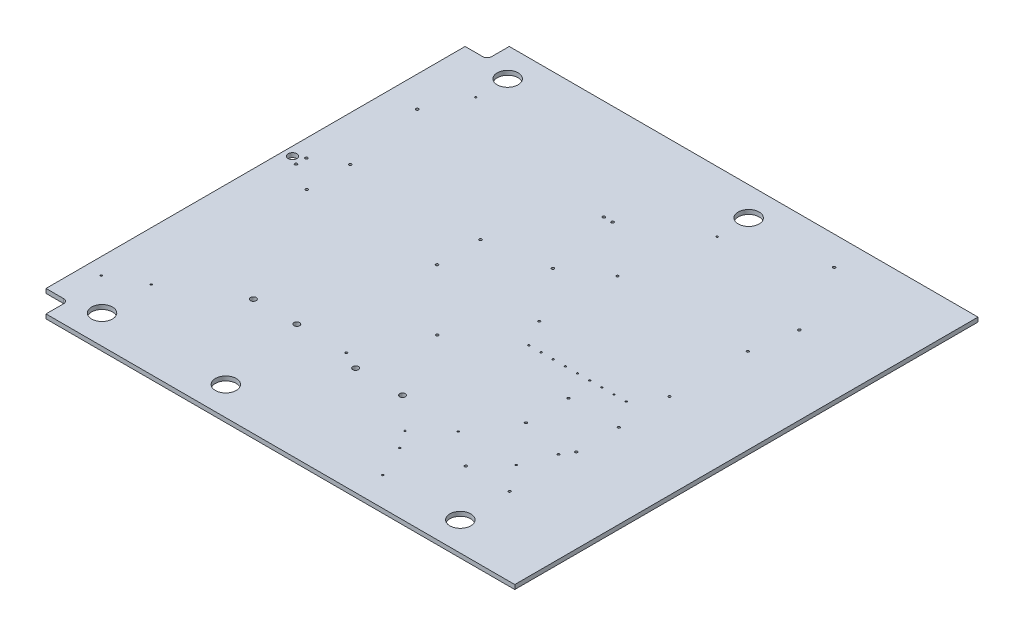
from build123d import *

# Parameters (mm, degrees)
SKETCH1_W                                     = 533.4
SKETCH1_H                                     = 5
BOSS_EXTRUDE1_DEPTH                           = 565.15
BOTTHOMHOLES_SKETCH2_R                        = 12
BOTTOMSTEPPERHOLES_CUT_EXTRUDE1_DEPTH         = 778.132602906
BOTTOMPSUHOLESSKETCH2_R                       = 1.5
BOTTOMPSUHOLESSKETCH2_R_2                     = 3.25
BOTTOMPSUHOLESCUT_EXTRUDE1_DEPTH              = 778.132602906
OCTOPUSHOLESSKETCH2_R                         = 1.35
OCTOPUSMOUNTHOLESCUT_EXTRUDE1_DEPTH           = 778.132602906
POWRCABLEGUIDEMOUNTHOLESSKETCH2_R             = 1.5
POWERCABLEGUIDEMOUNTHOLESCUT_EXTRUDE1_DEPTH   = 778.132602906
RPIHOLESSKETCH2_R                             = 1.35
RPIMOUNTHOLESCUT_EXTRUDE1_DEPTH               = 778.132602906
DRAGCHAINANDCABLEGUIDEHOLESSKETCH2_R          = 1.5
DRAGCHAINANDCABLEGUIDEHOLESSKETCH2_R_2        = 5
CRAGCHAINANDCABLEGUIDEHOLESCUT_EXTRUDE1_DEPTH = 778.132602906
SKETCH2_R                                     = 1
OCTOPUSROUTING_HOLESCUT_EXTRUDE1_DEPTH        = 778.132602906
PIPOWERANDSSRCONTROLSKETCH3_R                 = 1.25
PIPOWERANDSSRCONTROLCUTS_EXTRUDE1_DEPTH       = 778.132602906
CORNERCABLEKNOTCHCUT_EXTRUDE1_DEPTH           = 778.132602906
Z1_PATHSSKETCH4_R                             = 1.5
Z1_PATGSCUT_EXTRUDE1_DEPTH                    = 778.132602906
Z2PATHSSKETCH5_R                              = 1
Z2PATHSCUT_EXTRUDE2_DEPTH                     = 778.132602906
ZPATHSSKETCH4_R                               = 1.35
ZPATHSCUT_EXTRUDE1_DEPTH                      = 778.132602906
LEFTGANTRYANDEXTRUDERPATHSSKETCH4_R           = 1
LEFTGANTRYANDEXTRUDERPATHSCUT_EXTRUDE1_DEPTH  = 778.132602906
RIGHTGANTRYPATHSSKETCH5_R                     = 1
RIGHTGANTRYPATHSCUT_EXTRUDE2_DEPTH            = 778.132602906


with BuildPart() as part:
    # Sketch1 → Boss-Extrude1 (new body)
    with BuildSketch(Plane(origin=(0, 0, 0), x_dir=(0, 0, -1), z_dir=(1, 0, 0))):
        with Locations((-266.7, 2.5)):
            Rectangle(SKETCH1_W, SKETCH1_H)
    extrude(amount=BOSS_EXTRUDE1_DEPTH)

    # BotthomHoles-Sketch2 → BottomStepperHoles-Cut-Extrude1 (cut, through all)
    with BuildSketch(Plane(origin=(0, 5, 0), x_dir=(1, 0, 0), z_dir=(0, 1, 0))):
        with Locations(Location((334.275, -33.175, 0), (0, 0, 270))):
            Circle(BOTTHOMHOLES_SKETCH2_R)
        with Locations(Location((199.275, -500.225, 0), (0, 0, 270))):
            Circle(BOTTHOMHOLES_SKETCH2_R)
        with Locations(Location((469.275, -500.225, 0), (0, 0, 270))):
            Circle(BOTTHOMHOLES_SKETCH2_R)
        with Locations(Location((56.75, -500.225, 0), (0, 0, 270))):
            Circle(BOTTHOMHOLES_SKETCH2_R)
        with Locations(Location((56.75, -33.175, 0), (0, 0, 270))):
            Circle(BOTTHOMHOLES_SKETCH2_R)
    extrude(amount=-BOTTOMSTEPPERHOLES_CUT_EXTRUDE1_DEPTH, mode=Mode.SUBTRACT)

    # BottomPSUHolesSketch2 → BottomPSUHolesCut-Extrude1 (cut, through all)
    with BuildSketch(Plane(origin=(0, 5, 0), x_dir=(1, 0, 0), z_dir=(0, 1, 0))):
        with Locations(Location((201.5, -209.2, 0), (0, 0, 270))):
            Circle(BOTTOMPSUHOLESSKETCH2_R)
        with Locations(Location((201.5, -259.2, 0), (0, 0, 270))):
            Circle(BOTTOMPSUHOLESSKETCH2_R)
        with Locations(Location((51.5, -209.2, 0), (0, 0, 270))):
            Circle(BOTTOMPSUHOLESSKETCH2_R)
        with Locations(Location((51.5, -259.2, 0), (0, 0, 270))):
            Circle(BOTTOMPSUHOLESSKETCH2_R)
        with Locations(Location((180, -399.2, 0), (0, 0, 270))):
            Circle(BOTTOMPSUHOLESSKETCH2_R_2)
        with Locations(Location((130, -399.2, 0), (0, 0, 270))):
            Circle(BOTTOMPSUHOLESSKETCH2_R_2)
        with Locations(Location((257.75, -409.2, 0), (0, 0, 270))):
            Circle(BOTTOMPSUHOLESSKETCH2_R_2)
        with Locations(Location((311.75, -409.2, 0), (0, 0, 270))):
            Circle(BOTTOMPSUHOLESSKETCH2_R_2)
    extrude(amount=-BOTTOMPSUHOLESCUT_EXTRUDE1_DEPTH, mode=Mode.SUBTRACT)

    # OctopusHolesSketch2 → OctopusMountHolesCut-Extrude1 (cut, through all)
    with BuildSketch(Plane(origin=(0, 5, 0), x_dir=(1, 0, 0), z_dir=(0, 1, 0))):
        with Locations(Location((316.75, -256.7, 0), (0, 0, 270))):
            Circle(OCTOPUSHOLESSKETCH2_R)
        with Locations(Location((466.75, -256.7, 0), (0, 0, 270))):
            Circle(OCTOPUSHOLESSKETCH2_R)
        with Locations(Location((316.75, -166.7, 0), (0, 0, 270))):
            Circle(OCTOPUSHOLESSKETCH2_R)
        with Locations(Location((466.75, -166.7, 0), (0, 0, 270))):
            Circle(OCTOPUSHOLESSKETCH2_R)
    extrude(amount=-OCTOPUSMOUNTHOLESCUT_EXTRUDE1_DEPTH, mode=Mode.SUBTRACT)

    # PowrCableGuideMountHolesSketch2 → PowerCableGuideMountHolesCut-Extrude1 (cut, through all)
    with BuildSketch(Plane(origin=(0, 5, 0), x_dir=(1, 0, 0), z_dir=(0, 1, 0))):
        with Locations(Location((271.75, -329.2, 0), (0, 0, 270))):
            Circle(POWRCABLEGUIDEMOUNTHOLESSKETCH2_R)
        with Locations(Location((271.75, -196.2, 0), (0, 0, 270))):
            Circle(POWRCABLEGUIDEMOUNTHOLESSKETCH2_R)
    extrude(amount=-POWERCABLEGUIDEMOUNTHOLESCUT_EXTRUDE1_DEPTH, mode=Mode.SUBTRACT)

    # RPIHolesSketch2 → RPIMountHolesCut-Extrude1 (cut, through all)
    with BuildSketch(Plane(origin=(0, 5, 0), x_dir=(1, 0, 0), z_dir=(0, 1, 0))):
        with Locations(Location((468.25, -316.7, 0), (0, 0, 270))):
            Circle(RPIHOLESSKETCH2_R)
        with Locations(Location((468.25, -365.7, 0), (0, 0, 270))):
            Circle(RPIHOLESSKETCH2_R)
        with Locations(Location((410.25, -316.7, 0), (0, 0, 270))):
            Circle(RPIHOLESSKETCH2_R)
        with Locations(Location((410.25, -365.7, 0), (0, 0, 270))):
            Circle(RPIHOLESSKETCH2_R)
    extrude(amount=-RPIMOUNTHOLESCUT_EXTRUDE1_DEPTH, mode=Mode.SUBTRACT)

    # DragChainAndCableGuideHolesSketch2 → CragChainAndCableGuideHolesCut-Extrude1 (cut, through all)
    with BuildSketch(Plane(origin=(0, 5, 0), x_dir=(1, 0, 0), z_dir=(0, 1, 0))):
        with Locations(Location((260, -115.65, 0), (0, 0, 270))):
            Circle(DRAGCHAINANDCABLEGUIDEHOLESSKETCH2_R)
        with Locations(Location((10, -234.2, 0), (0, 0, 270))):
            Circle(DRAGCHAINANDCABLEGUIDEHOLESSKETCH2_R_2)
        with Locations(Location((475, -115.65, 0), (0, 0, 270))):
            Circle(DRAGCHAINANDCABLEGUIDEHOLESSKETCH2_R)
        with Locations(Location((250, -115.65, 0), (0, 0, 270))):
            Circle(DRAGCHAINANDCABLEGUIDEHOLESSKETCH2_R)
        with Locations(Location((35, -115.65, 0), (0, 0, 270))):
            Circle(DRAGCHAINANDCABLEGUIDEHOLESSKETCH2_R)
        with Locations(Location((20, -240.2, 0), (0, 0, 270))):
            Circle(DRAGCHAINANDCABLEGUIDEHOLESSKETCH2_R)
        with Locations(Location((20, -228.2, 0), (0, 0, 270))):
            Circle(DRAGCHAINANDCABLEGUIDEHOLESSKETCH2_R)
    extrude(amount=-CRAGCHAINANDCABLEGUIDEHOLESCUT_EXTRUDE1_DEPTH, mode=Mode.SUBTRACT)

    # Sketch2 → OctopusRouting holesCut-Extrude1 (cut, through all)
    with BuildSketch(Plane(origin=(0, 5, 0), x_dir=(1, 0, 0), z_dir=(0, 1, 0))):
        with Locations(Location((334.75, -286.7, 0), (0, 0, 270))):
            Circle(SKETCH2_R)
        with Locations(Location((348.75, -286.7, 0), (0, 0, 270))):
            Circle(SKETCH2_R)
        with Locations(Location((362.75, -286.7, 0), (0, 0, 270))):
            Circle(SKETCH2_R)
        with Locations(Location((376.75, -286.7, 0), (0, 0, 270))):
            Circle(SKETCH2_R)
        with Locations(Location((390.75, -286.7, 0), (0, 0, 270))):
            Circle(SKETCH2_R)
        with Locations(Location((404.75, -286.7, 0), (0, 0, 270))):
            Circle(SKETCH2_R)
        with Locations(Location((418.75, -286.7, 0), (0, 0, 270))):
            Circle(SKETCH2_R)
        with Locations(Location((432.75, -286.7, 0), (0, 0, 270))):
            Circle(SKETCH2_R)
        with Locations(Location((446.75, -286.7, 0), (0, 0, 270))):
            Circle(SKETCH2_R)
    extrude(amount=-OCTOPUSROUTING_HOLESCUT_EXTRUDE1_DEPTH, mode=Mode.SUBTRACT)

    # PiPowerAndSSRControlSketch3 → PiPowerAndSSRControlCuts-Extrude1 (cut, through all)
    with BuildSketch(Plane(origin=(0, 5, 0), x_dir=(1, 0, 0), z_dir=(0, 1, 0))):
        with Locations(Location((237, -399.2, 0), (0, 0, 270))):
            Circle(PIPOWERANDSSRCONTROLSKETCH3_R)
        with Locations(Location((460.5, -378.4, 0), (0, 0, 270))):
            Circle(PIPOWERANDSSRCONTROLSKETCH3_R)
    extrude(amount=-PIPOWERANDSSRCONTROLCUTS_EXTRUDE1_DEPTH, mode=Mode.SUBTRACT)

    # CornerCableKnotchesSketch4 → CornerCableKnotchCut-Extrude1 (cut, through all)
    with BuildSketch(Plane(origin=(0, 5, 0), x_dir=(1, 0, 0), z_dir=(0, 1, 0))):
        with BuildLine():
            Line((0, -25.4), (20.4, -25.4))
            ThreePointArc((20.4, -25.4), (23.935533906, -23.935533906), (25.4, -20.4))
            Line((25.4, -20.4), (25.4, 0))
            Line((25.4, 0), (0, 0))
            Line((0, 0), (0, -25.4))
        make_face()
        with BuildLine():
            Line((0, -508), (20.4, -508))
            ThreePointArc((20.4, -508), (23.935533906, -509.464466094), (25.4, -513))
            Line((25.4, -513), (25.4, -533.4))
            Line((25.4, -533.4), (0, -533.4))
            Line((0, -533.4), (0, -508))
        make_face()
    extrude(amount=-CORNERCABLEKNOTCHCUT_EXTRUDE1_DEPTH, mode=Mode.SUBTRACT)

    # Z1 pathsSketch4 → Z1 patgsCut-Extrude1 (cut, through all)
    with BuildSketch(Plane(origin=(0, 5, 0), x_dir=(1, 0, 0), z_dir=(0, 1, 0))):
        with Locations(Location((432.75, -33.175, 0), (0, 0, 270))):
            Circle(Z1_PATHSSKETCH4_R)
    extrude(amount=-Z1_PATGSCUT_EXTRUDE1_DEPTH, mode=Mode.SUBTRACT)

    # Z2PathsSketch5 → Z2PathsCut-Extrude2 (cut, through all)
    with BuildSketch(Plane(origin=(0, 5, 0), x_dir=(1, 0, 0), z_dir=(0, 1, 0))):
        with Locations(Location((380, -500.225, 0), (0, 0, 270))):
            Circle(Z2PATHSSKETCH5_R)
        with Locations(Location((380, -413.4, 0), (0, 0, 270))):
            Circle(Z2PATHSSKETCH5_R)
        with Locations(Location((446.75, -413.4, 0), (0, 0, 270))):
            Circle(Z2PATHSSKETCH5_R)
    extrude(amount=-Z2PATHSCUT_EXTRUDE2_DEPTH, mode=Mode.SUBTRACT)

    # ZPathsSketch4 → ZPathsCut-Extrude1 (cut, through all)
    with BuildSketch(Plane(origin=(0, 5, 0), x_dir=(1, 0, 0), z_dir=(0, 1, 0))):
        with Locations(Location((469.275, -443.4, 0), (0, 0, 270))):
            Circle(ZPATHSSKETCH4_R)
        with Locations(Location((418.75, -443.4, 0), (0, 0, 270))):
            Circle(ZPATHSSKETCH4_R)
    extrude(amount=-ZPATHSCUT_EXTRUDE1_DEPTH, mode=Mode.SUBTRACT)

    # LeftGantryAndExtruderPathsSketch4 → LeftGantryAndExtruderPathsCut-Extrude1 (cut, through all)
    with BuildSketch(Plane(origin=(0, 5, 0), x_dir=(1, 0, 0), z_dir=(0, 1, 0))):
        with Locations(Location((348.75, -443.4, 0), (0, 0, 270))):
            Circle(LEFTGANTRYANDEXTRUDERPATHSSKETCH4_R)
        with Locations(Location((362.75, -463.4, 0), (0, 0, 270))):
            Circle(LEFTGANTRYANDEXTRUDERPATHSSKETCH4_R)
        with Locations(Location((56.75, -443.4, 0), (0, 0, 270))):
            Circle(LEFTGANTRYANDEXTRUDERPATHSSKETCH4_R)
        with Locations(Location((19, -463.4, 0), (0, 0, 270))):
            Circle(LEFTGANTRYANDEXTRUDERPATHSSKETCH4_R)
    extrude(amount=-LEFTGANTRYANDEXTRUDERPATHSCUT_EXTRUDE1_DEPTH, mode=Mode.SUBTRACT)

    # RightGantryPathsSketch5 → RightGantryPathsCut-Extrude2 (cut, through all)
    with BuildSketch(Plane(origin=(0, 5, 0), x_dir=(1, 0, 0), z_dir=(0, 1, 0))):
        with Locations(Location((334.75, -70, 0), (0, 0, 270))):
            Circle(RIGHTGANTRYPATHSSKETCH5_R)
        with Locations(Location((56.75, -70, 0), (0, 0, 270))):
            Circle(RIGHTGANTRYPATHSSKETCH5_R)
    extrude(amount=-RIGHTGANTRYPATHSCUT_EXTRUDE2_DEPTH, mode=Mode.SUBTRACT)


solid = part.part
